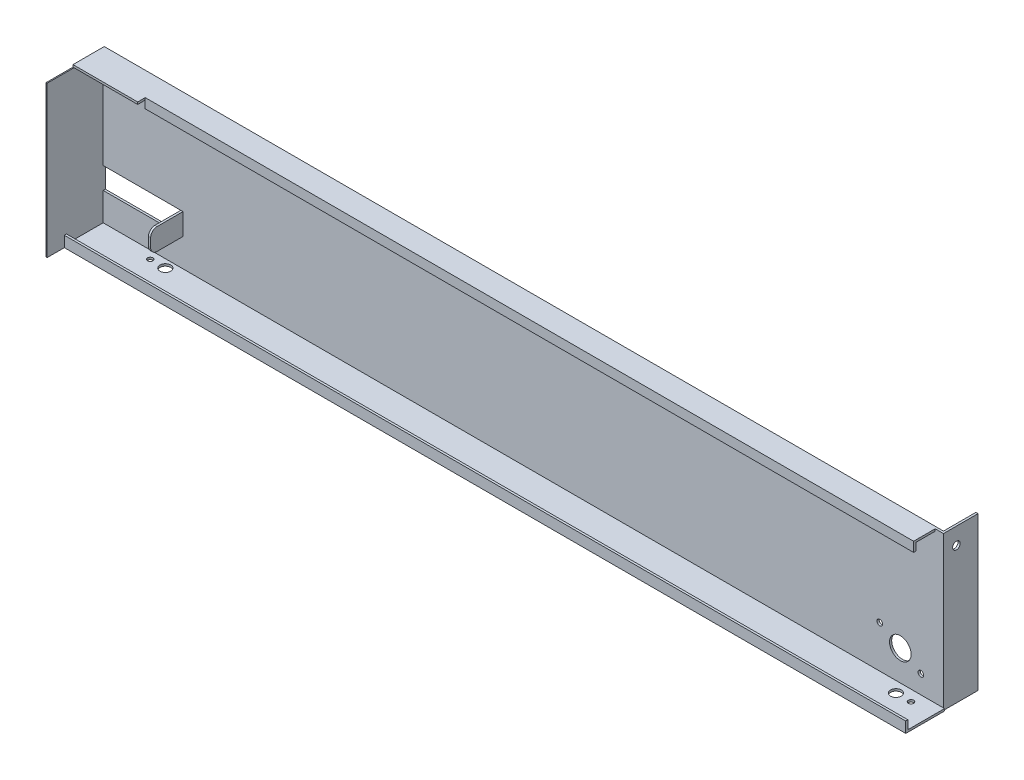
from build123d import *

# Parameters (mm, degrees)
CROQUIS1_W               = 390
CROQUIS1_H               = 71
SALIENTE_EXTRUIR1_DEPTH  = 1
CROQUIS3_W               = 356.15
CROQUIS3_H               = 1
SALIENTE_EXTRUIR3_DEPTH  = 10
CROQUIS4_W               = 356.15
CROQUIS4_H               = 1
SALIENTE_EXTRUIR4_DEPTH  = 3.5
CROQUIS5_W               = 30
CROQUIS5_H               = 1
SALIENTE_EXTRUIR5_DEPTH  = 13.5
CROQUIS6_W               = 0.5
CROQUIS6_H               = 70
SALIENTE_EXTRUIR6_DEPTH  = 26
CROQUIS7_W               = 390
CROQUIS7_H               = 1
SALIENTE_EXTRUIR7_DEPTH  = 18
CROQUIS8_W               = 390
CROQUIS8_H               = 1
SALIENTE_EXTRUIR8_DEPTH  = 4
CORTAR_EXTRUIR1_REACH    = 202.391
CROQUIS11_W              = 36
CROQUIS11_H              = 10
CROQUIS12_W              = 1
CROQUIS12_H              = 10
SALIENTE_EXTRUIR11_DEPTH = 15
REDONDEO1_R              = 3
CROQUIS13_R              = 2
SALIENTE_EXTRUIR12_DEPTH = 1
CORTAR_EXTRUIR2_REACH    = 395.039
CROQUIS14_R              = 1.75
CROQUIS16_R              = 5
CROQUIS16_R_2            = 1.3
CORTAR_EXTRUIR4_DEPTH    = 1
CROQUIS25_R              = 1.25
CROQUIS25_R_2            = 2.5
CORTAR_EXTRUIR5_DEPTH    = 1
CROQUIS30_W              = 1
CROQUIS30_H              = 71
SALIENTE_EXTRUIR15_DEPTH = 15
CROQUIS31_R              = 1.75
CORTAR_EXTRUIR12_DEPTH   = 1


with BuildPart() as part:
    # Croquis1 → Saliente-Extruir1 (new body)
    with BuildSketch(Plane.XY):
        Rectangle(CROQUIS1_W, CROQUIS1_H)
    extrude(amount=SALIENTE_EXTRUIR1_DEPTH)

    # Croquis3 → Saliente-Extruir3 (add)
    with BuildSketch(Plane.XY.offset(1)):
        with Locations((13.075, 35)):
            Rectangle(CROQUIS3_W, CROQUIS3_H)
    extrude(amount=SALIENTE_EXTRUIR3_DEPTH)

    # Croquis4 → Saliente-Extruir4 (add)
    with BuildSketch(Plane.XZ.offset(-34.5)):
        with Locations((13.075, 10.5)):
            Rectangle(CROQUIS4_W, CROQUIS4_H)
    extrude(amount=SALIENTE_EXTRUIR4_DEPTH)

    # Croquis5 → Saliente-Extruir5 (add)
    with BuildSketch(Plane.XY.offset(1)):
        with Locations((-180, 35)):
            Rectangle(CROQUIS5_W, CROQUIS5_H)
    extrude(amount=SALIENTE_EXTRUIR5_DEPTH)

    # Croquis6 → Saliente-Extruir6 (add)
    with BuildSketch(Plane.XY.offset(1)):
        with Locations((-194.75, -0.5)):
            Rectangle(CROQUIS6_W, CROQUIS6_H)
    extrude(amount=SALIENTE_EXTRUIR6_DEPTH)

    # Croquis7 → Saliente-Extruir7 (add)
    with BuildSketch(Plane.XY.offset(1)):
        with Locations((0.5, -35)):
            Rectangle(CROQUIS7_W, CROQUIS7_H)
    extrude(amount=SALIENTE_EXTRUIR7_DEPTH)

    # Croquis8 → Saliente-Extruir8 (add)
    with BuildSketch(Plane(origin=(0, -34.5, 0), x_dir=(1, 0, 0), z_dir=(0, 1, 0))):
        with Locations((0.5, -18.5)):
            Rectangle(CROQUIS8_W, CROQUIS8_H)
    extrude(amount=SALIENTE_EXTRUIR8_DEPTH)

    # Croquis11 → Cortar-Extruir1 (cut, up to next)
    with BuildSketch(Plane.XY.offset(1), mode=Mode.PRIVATE) as cortar_extruir1_sk1:
        with Locations((-176.5, -16.5)):
            Rectangle(CROQUIS11_W, CROQUIS11_H)
    cortar_extruir1_tool1 = extrude(cortar_extruir1_sk1.sketch, amount=-CORTAR_EXTRUIR1_REACH, mode=Mode.PRIVATE) & part.part
    add(cortar_extruir1_tool1.solids().sort_by_distance((-176.5, -16.5, 1))[0], mode=Mode.SUBTRACT)

    # Croquis12 → Saliente-Extruir11 (add)
    with BuildSketch(Plane.XY.offset(1)):
        with Locations((-158, -16.5)):
            Rectangle(CROQUIS12_W, CROQUIS12_H)
    extrude(amount=SALIENTE_EXTRUIR11_DEPTH)

    # Redondeo1
    redondeo1_edges = [part.edges().sort_by_distance(p)[0] for p in [
        (-158, -21.5, 16),
        (-158, -11.5, 16),
    ]]
    fillet(redondeo1_edges, radius=REDONDEO1_R)

    # Croquis13 → Saliente-Extruir12 (add)
    with BuildSketch(Plane.ZY.offset(158.5)):
        with Locations(Location((10.5, -16.5, 0), (0, 0, 180))):
            Circle(CROQUIS13_R)
    extrude(amount=SALIENTE_EXTRUIR12_DEPTH)

    # Croquis14 → Cortar-Extruir2 (cut, up to next)
    with BuildSketch(Plane.ZY.offset(195), mode=Mode.PRIVATE) as cortar_extruir2_sk1:
        with Locations((5.81, 30.25)):
            Circle(CROQUIS14_R)
    cortar_extruir2_tool1 = extrude(cortar_extruir2_sk1.sketch, amount=-CORTAR_EXTRUIR2_REACH, mode=Mode.PRIVATE) & part.part
    add(cortar_extruir2_tool1.solids().sort_by_distance((-195, 30.25, 5.81))[0], mode=Mode.SUBTRACT)

    # Croquis16 → Cortar-Extruir4 (cut)
    with BuildSketch(Plane.XY.offset(1)):
        with Locations((175, -20.5)):
            Circle(CROQUIS16_R)
        with Locations((184.526279442, -26)):
            Circle(CROQUIS16_R_2)
        with Locations((165.473720558, -15)):
            Circle(CROQUIS16_R_2)
    extrude(amount=-CORTAR_EXTRUIR4_DEPTH, mode=Mode.SUBTRACT)

    # Croquis25 → Cortar-Extruir5 (cut)
    with BuildSketch(Plane.XZ.offset(35.5)):
        with Locations((-168.9, 4.78)):
            Circle(CROQUIS25_R)
        with Locations((-161.9, 4.78)):
            Circle(CROQUIS25_R_2)
        with Locations((185, 6.05)):
            Circle(CROQUIS25_R)
        with Locations((178, 6.05)):
            Circle(CROQUIS25_R_2)
    extrude(amount=-CORTAR_EXTRUIR5_DEPTH, mode=Mode.SUBTRACT)

    # Croquis30 → Saliente-Extruir15 (add)
    with BuildSketch(Plane(origin=(0, 0, 0), x_dir=(-1, 0, 0), z_dir=(0, 0, -1))):
        with Locations((-194.5, 0)):
            Rectangle(CROQUIS30_W, CROQUIS30_H)
    extrude(amount=SALIENTE_EXTRUIR15_DEPTH)

    # Croquis31 → Cortar-Extruir12 (cut)
    with BuildSketch(Plane(origin=(195, 0, 0), x_dir=(0, 0, -1), z_dir=(1, 0, 0))):
        with Locations((5, 27.7)):
            Circle(CROQUIS31_R)
    extrude(amount=-CORTAR_EXTRUIR12_DEPTH, mode=Mode.SUBTRACT)


solid = part.part
